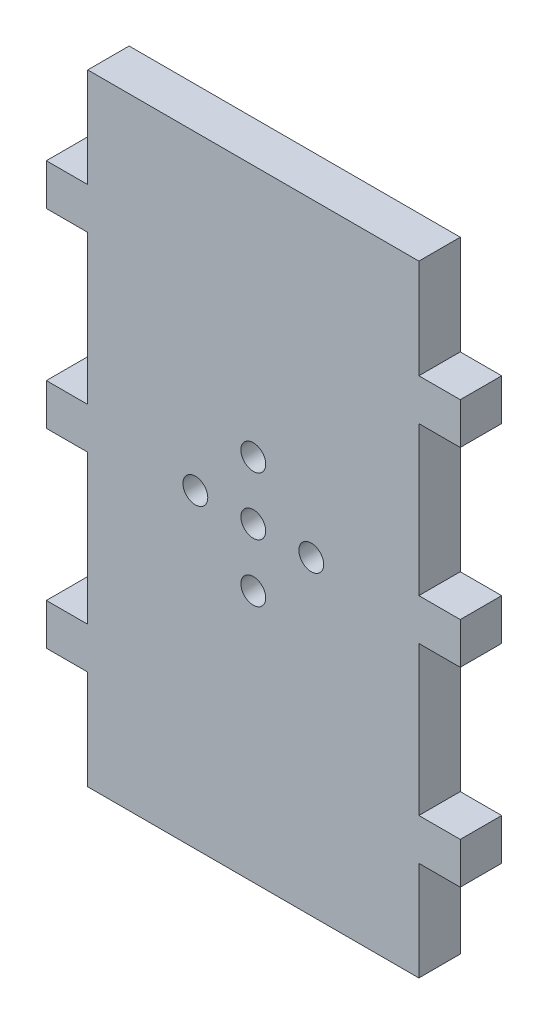
from build123d import *

# Parameters (mm, degrees)
SKETCH_3_R      = 1.5
EXTRUDE_2_DEPTH = 5


with BuildPart() as part:
    # 草图3 → 凸台-拉伸2 (new body)
    with BuildSketch(Plane.XY):
        Polygon((0, 9.970342372), (0, -2.029657628), (-5, -2.029657628), (-5, -7.029657628), (0, -7.029657628), (0, -25.029657628), (-5, -25.029657628), (-5, -30.029657628), (0, -30.029657628), (0, -48.029657628), (-5, -48.029657628), (-5, -53.029657628), (0, -53.029657628), (0, -65.029657628), (40, -65.029657628), (40, -53.029657628), (45, -53.029657628), (45, -48.029657628), (40, -48.029657628), (40, -30.029657628), (45, -30.029657628), (45, -25.029657628), (40, -25.029657628), (40, -7.029657628), (45, -7.029657628), (45, -2.029657628), (40, -2.029657628), (40, 9.970342372), align=None)
        with Locations((20, -27.529999998)):
            Circle(SKETCH_3_R, mode=Mode.SUBTRACT)
        with Locations((27, -27.529999998)):
            Circle(SKETCH_3_R, mode=Mode.SUBTRACT)
        with Locations((20, -20.529999998)):
            Circle(SKETCH_3_R, mode=Mode.SUBTRACT)
        with Locations((13, -27.529999998)):
            Circle(SKETCH_3_R, mode=Mode.SUBTRACT)
        with Locations((20, -34.529999998)):
            Circle(SKETCH_3_R, mode=Mode.SUBTRACT)
    extrude(amount=EXTRUDE_2_DEPTH)


solid = part.part
